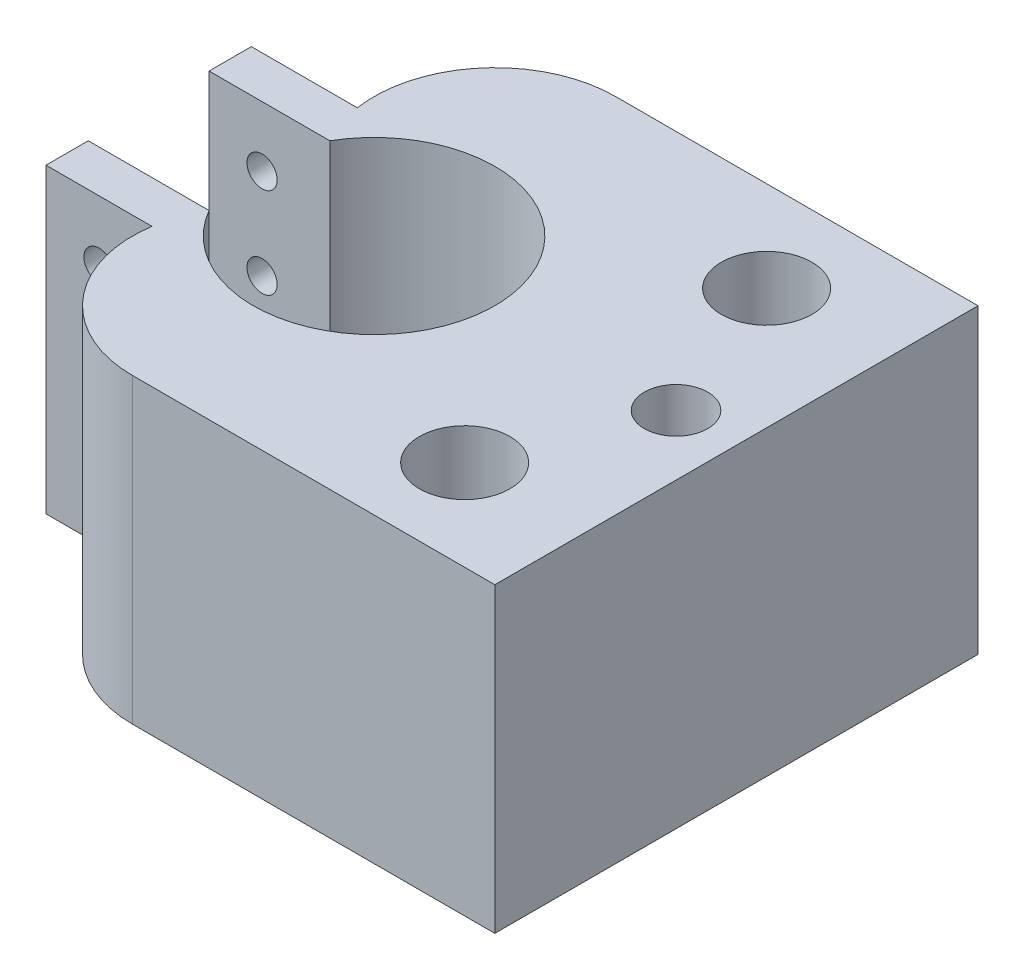
from build123d import *

# Parameters (mm, degrees)
SKETCH1_R           = 7.5
SKETCH1_R_2         = 5.25
BOSS_EXTRUDE1_DEPTH = 50
SKETCH2_R           = 2.5
CUT_EXTRUDE1_DEPTH  = 50


with BuildPart() as part:
    # Sketch1 → Boss-Extrude1 (new body)
    with BuildSketch(Plane(origin=(0, 0, 0), x_dir=(1, 0, 0), z_dir=(0, 1, 0))):
        with BuildLine():
            Line((-20, 40.822928267), (40, 40.822928267))
            Line((40, 40.822928267), (40, -39.177071733))
            Line((40, -39.177071733), (-20, -39.177071733))
            ThreePointArc((-20, -39.177071733), (-35.165750888, -32.215476544), (-39.773719933, -16.177071733))
            Line((-39.773719933, -16.177071733), (-57.320508076, -16.177071733))
            Line((-57.320508076, -16.177071733), (-57.320508076, -9.177071733))
            Line((-57.320508076, -9.177071733), (-37.320508076, -9.177071733))
            ThreePointArc((-37.320508076, -9.177071733), (0, 0.822928267), (-37.320508076, 10.822928267))
            Line((-37.320508076, 10.822928267), (-57.320508076, 10.822928267))
            Line((-57.320508076, 10.822928267), (-57.320508076, 17.822928267))
            Line((-57.320508076, 17.822928267), (-39.773719933, 17.822928267))
            ThreePointArc((-39.773719933, 17.822928267), (-35.165750888, 33.861333077), (-20, 40.822928267))
        make_face()
        with Locations(Location((20, 25.822928267, 0), (0, 0, 270))):
            Circle(SKETCH1_R, mode=Mode.SUBTRACT)
        with Locations(Location((20, -24.177071733, 0), (0, 0, 90))):
            Circle(SKETCH1_R, mode=Mode.SUBTRACT)
        with Locations(Location((30, 0.822928267, 0), (0, 0, 270))):
            Circle(SKETCH1_R_2, mode=Mode.SUBTRACT)
    extrude(amount=BOSS_EXTRUDE1_DEPTH)

    # Sketch2 → Cut-Extrude1 (cut)
    with BuildSketch(Plane.XY.offset(16.177071733)):
        with Locations((-48.547114004, 40)):
            Circle(SKETCH2_R)
        with Locations((-48.547114004, 25)):
            Circle(SKETCH2_R)
        with Locations((-48.547114004, 10)):
            Circle(SKETCH2_R)
    extrude(amount=-CUT_EXTRUDE1_DEPTH, mode=Mode.SUBTRACT)


solid = part.part
